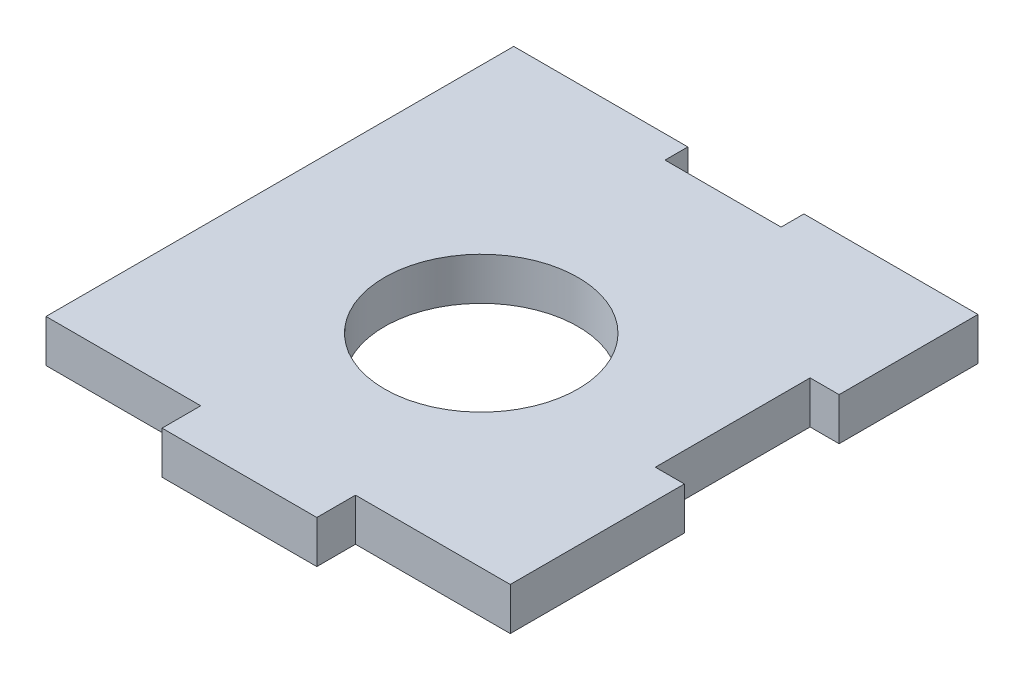
from build123d import *

# Parameters (mm, degrees)
SKETCH1_R           = 5
BOSS_EXTRUDE1_DEPTH = 2.2


with BuildPart() as part:
    # Sketch1 → Boss-Extrude1 (new body)
    with BuildSketch(Plane(origin=(0, 0, 0), x_dir=(1, 0, 0), z_dir=(0, 1, 0))):
        Polygon((-154.536383046, 11.329521193), (-146.536383046, 11.329521193), (-146.536383046, 13.329521193), (-138.536383046, 13.329521193), (-138.536383046, 16.329521193), (-138.536383046, 22.329521193), (-140.036383046, 22.329521193), (-140.036383046, 30.329521193), (-138.536383046, 30.329521193), (-138.536383046, 36.329521193), (-138.536383046, 37.509521193), (-147.536383046, 37.509521193), (-147.536383046, 36.329521193), (-153.536383046, 36.329521193), (-153.536383046, 37.509521193), (-162.536383046, 37.509521193), (-162.536383046, 36.329521193), (-162.536383046, 13.329521193), (-154.536383046, 13.329521193), align=None)
        with Locations(Location((-150.536383046, 23.829521193, 0), (0, 0, 270))):
            Circle(SKETCH1_R, mode=Mode.SUBTRACT)
    extrude(amount=BOSS_EXTRUDE1_DEPTH)


solid = part.part
